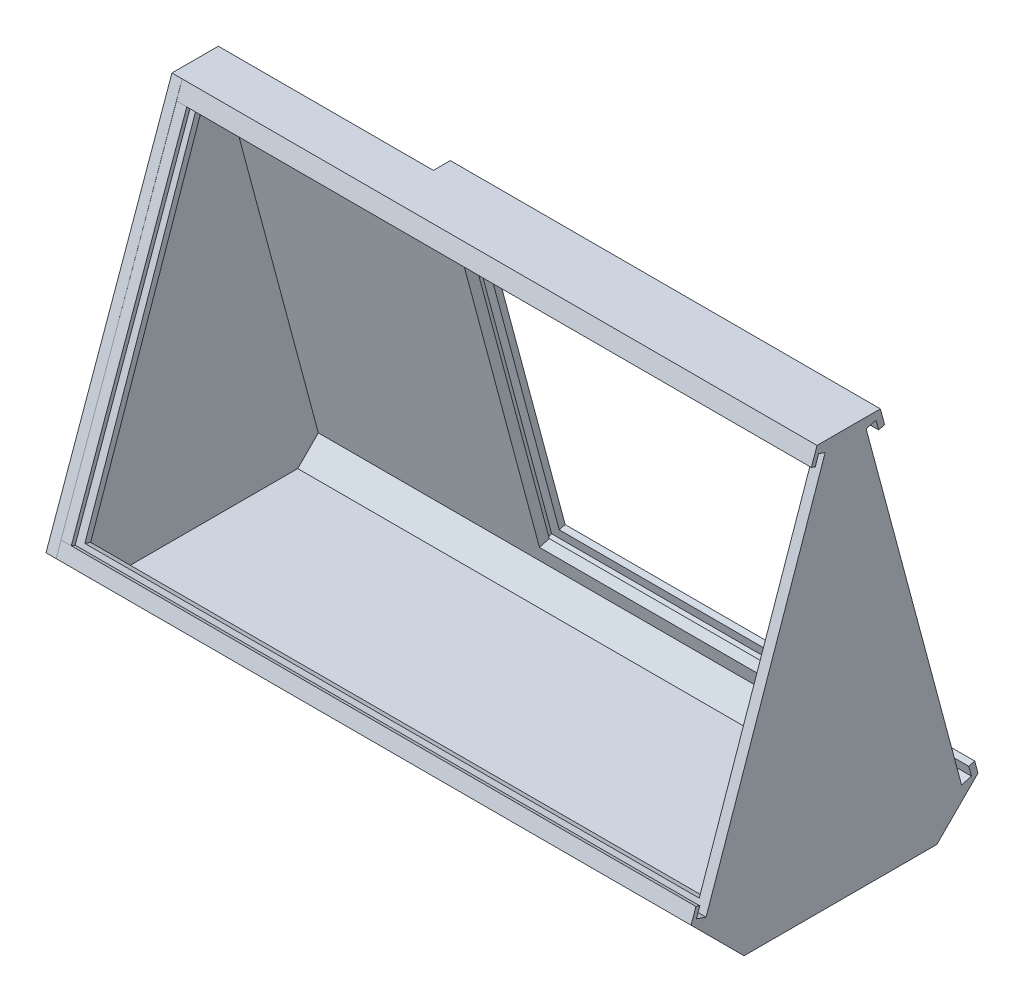
from build123d import *

# Parameters (mm, degrees)
BOSS_EXTRUDE2_DEPTH      = 6.35
BOSS_EXTRUDE3_DEPTH      = 254
BOSS_EXTRUDE3_DEPTH_BACK = 6.35
BOSS_EXTRUDE4_DEPTH      = 254
BOSS_EXTRUDE4_DEPTH_BACK = 6.35
BOSS_EXTRUDE5_DEPTH      = 133.35
BOSS_EXTRUDE6_DEPTH      = 6.35
BOSS_EXTRUDE8_DEPTH      = 6.35
BOSS_EXTRUDE9_DEPTH      = 6.35
BOSS_EXTRUDE10_DEPTH     = 6.35


with BuildPart() as part:
    # 3DSketch1 → Boss-Extrude2 (new body)
    with BuildSketch(Plane(origin=(0, 1.332156405, 65.630699338), x_dir=(0, 0.9561985348142941, -0.2927189129847902), z_dir=(-1, 0, 0))):
        Polygon((0, 0), (33.457771754, 109.293492529), (55.888968865, 121.2099264), (249.70876595, 0), (242.27370556, -24.287442784), (17.363491096, -32.684601412), align=None)
    extrude(amount=BOSS_EXTRUDE2_DEPTH)

    # Sketch2 → Boss-Extrude3 (add, two sides: drawn at the far end of the back side and taken through both)
    with BuildSketch(Plane.ZY.offset(6.35).offset(-BOSS_EXTRUDE3_DEPTH_BACK)):
        Polygon((-61.445059615, 14.107915358), (-48.669300662, 1.332156405), (65.630699338, 1.332156405), (88.807649546, 24.509106613), (86.118065358, 32.250379724), (89.717035392, 33.500785537), (91.80104508, 27.502502147), (97.799328469, 29.586511835), (95.715318781, 35.584795224), (98.114632137, 36.4183991), (101.101183052, 27.822383999), (68.260955459, -5.017843595), (-51.299556783, -5.017843595), (-76.823169583, 20.505769205), (-74.800118363, 28.055899142), (-71.119940965, 27.069798581), (-72.763441901, 20.936169584), (-66.629812904, 19.292668647), (-64.986311968, 25.426297644), (-58.852682971, 23.782796708), align=None)
    extrude(amount=BOSS_EXTRUDE3_DEPTH + BOSS_EXTRUDE3_DEPTH_BACK)

    # Sketch4 → Boss-Extrude4 (add, two sides: drawn at the far end of the back side and taken through both)
    with BuildSketch(Plane.ZY.offset(6.35).offset(-BOSS_EXTRUDE4_DEPTH_BACK)):
        Polygon((-0.889775448, 240.103312537), (13.902816842, 240.103312537), (16.42126046, 232.854623335), (20.020230494, 234.105029148), (17.936220806, 240.103312537), (22.024731964, 241.523801752), (24.108741651, 235.525518362), (26.508055007, 236.359122237), (23.000986566, 246.453312537), (-16.280707815, 246.453312537), (-18.921086525, 236.599285038), (-15.240909127, 235.613184476), (-13.597408191, 241.746813473), (-7.463779194, 240.103312537), (-9.10728013, 233.96968354), (-2.973651133, 232.326182604), align=None)
    extrude(amount=BOSS_EXTRUDE4_DEPTH + BOSS_EXTRUDE4_DEPTH_BACK)

    # Sketch5 → Boss-Extrude5 (add)
    with BuildSketch(Plane.ZY.offset(260.35)):
        Polygon((-68.52756432, 12.210163942), (-51.299556783, -5.017843595), (68.260955459, -5.017843595), (101.101183052, 27.822383999), (98.114632137, 36.4183991), (95.715318781, 35.584795224), (97.799328469, 29.586511835), (91.80104508, 27.502502147), (89.717035392, 33.500785537), (86.118065358, 32.250379724), (88.807649546, 24.509106613), (65.630699338, 1.332156405), (-48.669300662, 1.332156405), (-61.445059615, 14.107915358), (-0.889775448, 240.103312537), (13.902816842, 240.103312537), (16.42126046, 232.854623335), (20.020230494, 234.105029148), (17.936220806, 240.103312537), (22.024731964, 241.523801752), (24.108741651, 235.525518362), (26.508055007, 236.359122237), (23.000986566, 246.453312537), (-5.762301822, 246.453312537), align=None)
    extrude(amount=BOSS_EXTRUDE5_DEPTH)

    # Sketch7 → Boss-Extrude6 (add)
    with BuildSketch(Plane.ZY.offset(260.35)):
        Polygon((-16.280707815, 246.453312537), (-76.823169583, 20.505769205), (-68.52756432, 12.210163942), (-5.762301822, 246.453312537), align=None)
    extrude(amount=BOSS_EXTRUDE6_DEPTH)

    # Sketch9 → Boss-Extrude8 (add)
    with BuildSketch(Plane(origin=(-260.35, 0, 0), x_dir=(0, 0, -1), z_dir=(1, 0, 0))):
        Polygon((15.240909127, 235.613184476), (71.119940965, 27.069798581), (74.800118363, 28.055899142), (18.921086525, 236.599285038), align=None)
        Polygon((2.973651133, 232.326182604), (9.10728013, 233.96968354), (64.986311968, 25.426297644), (58.852682971, 23.782796708), align=None)
    extrude(amount=BOSS_EXTRUDE8_DEPTH)

    # Sketch11 → Boss-Extrude9 (add)
    with BuildSketch(Plane.ZY.offset(393.7)):
        Polygon((23.000986566, 246.453312537), (101.101183052, 27.822383999), (68.260955459, -5.017843595), (-51.299556783, -5.017843595), (-68.52756432, 12.210163942), (-5.762301822, 246.453312537), align=None)
    extrude(amount=BOSS_EXTRUDE9_DEPTH)

    # Sketch12 → Boss-Extrude10 (add)
    with BuildSketch(Plane(origin=(-393.7, 0, 0), x_dir=(0, 0, -1), z_dir=(1, 0, 0))):
        Polygon((-24.108741651, 235.525518362), (-26.508055007, 236.359122237), (-98.114632137, 36.4183991), (-95.715318781, 35.584795224), align=None)
        Polygon((-20.020230494, 234.105029148), (-16.42126046, 232.854623335), (-86.118065358, 32.250379724), (-89.717035392, 33.500785537), align=None)
    extrude(amount=BOSS_EXTRUDE10_DEPTH)


solid = part.part
